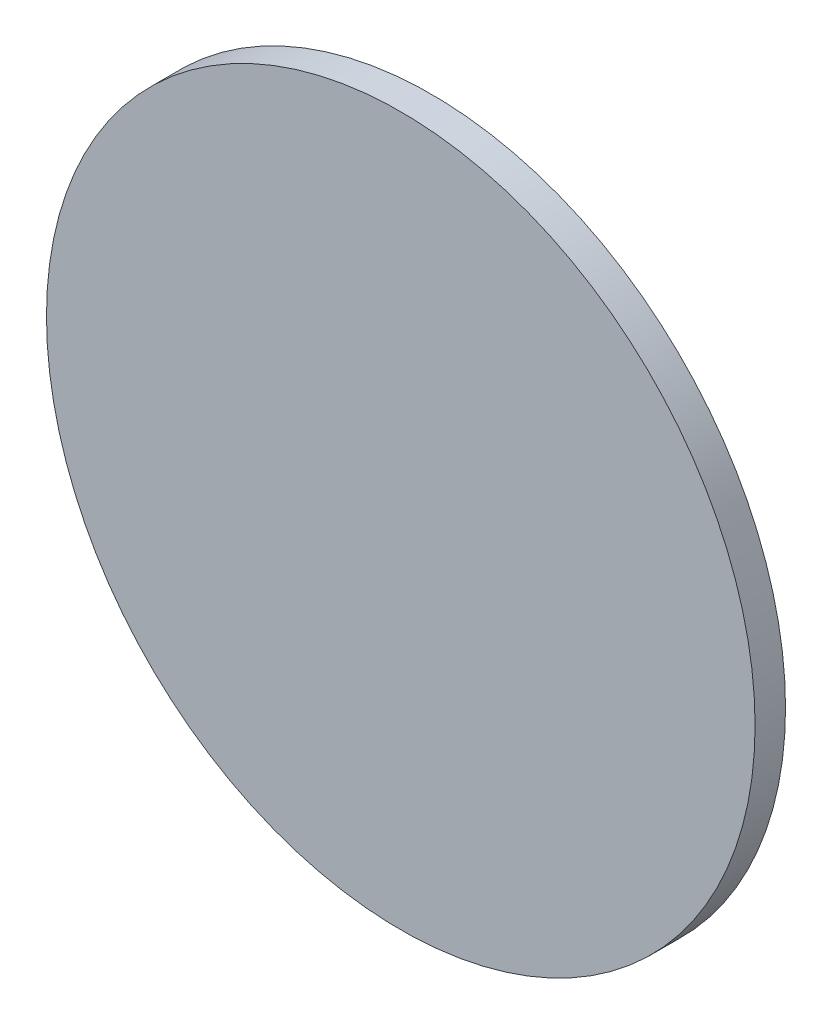
from build123d import *

# Parameters (mm, degrees)
ESQUISSE1_R        = 73.914
BOSS_EXTRU_1_DEPTH = 6.35


with BuildPart() as part:
    # Esquisse1 → Boss.-Extru.1 (new body)
    with BuildSketch(Plane.XY):
        Circle(ESQUISSE1_R)
    extrude(amount=BOSS_EXTRU_1_DEPTH)


solid = part.part
